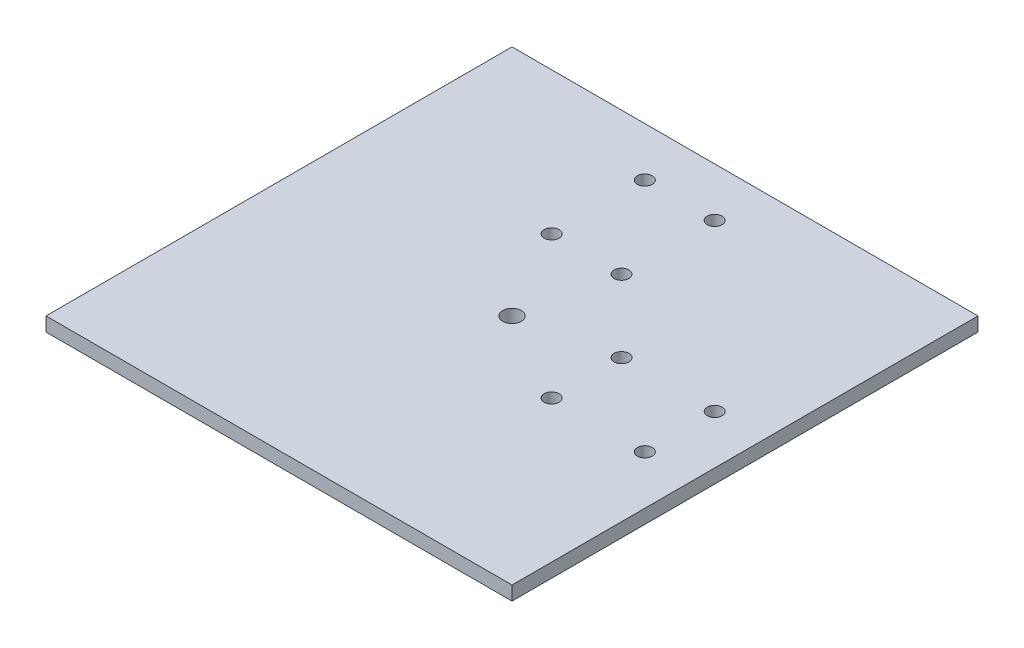
from build123d import *

# Parameters (mm, degrees)
SKETCH2_W                = 100
SKETCH2_H                = 100
BOSS_EXTRUDE1_DEPTH      = 3
SKETCH8_R                = 3
BOSS_EXTRUDE2_DEPTH      = 15.1
M3_CLEARANCE_HOLE1_D     = 3.2
F_4_0_4_DIAMETER_HOLE1_D = 4


with BuildPart() as part:
    # Sketch2 → Boss-Extrude1 (new body)
    with BuildSketch(Plane(origin=(0, 0, 0), x_dir=(1, 0, 0), z_dir=(0, 1, 0))):
        Rectangle(SKETCH2_W, SKETCH2_H)
    extrude(amount=BOSS_EXTRUDE1_DEPTH)

    # Sketch8 → Boss-Extrude2 (add)
    with BuildSketch(Plane.XZ):
        with Locations(Location((-11, -19.5, 0), (0, 0, 90))):
            Circle(SKETCH8_R)
        with Locations(Location((4, -19.5, 0), (0, 0, 90))):
            Circle(SKETCH8_R)
        with Locations(Location((4, -39.5, 0), (0, 0, 90))):
            Circle(SKETCH8_R)
        with Locations(Location((-11, -39.5, 0), (0, 0, 90))):
            Circle(SKETCH8_R)
    extrude(amount=BOSS_EXTRUDE2_DEPTH)

    # M3 Clearance Hole1 (through all)
    with Locations(Plane(origin=(0, 3, 0), x_dir=(1, 0, 0), z_dir=(0, 1, 0))):
        with Locations((-11, 39.5), (4, 39.5), (4, 19.5), (-11, 19.5), (19.5, 4), (39.5, 4), (39.5, -11), (19.5, -11)):
            Hole(M3_CLEARANCE_HOLE1_D / 2)

    # Ø4.0 (4) Diameter Hole1 (through all)
    with Locations(Plane(origin=(0, 3, 0), x_dir=(1, 0, 0), z_dir=(0, 1, 0))):
        with Locations((0, 0)):
            Hole(F_4_0_4_DIAMETER_HOLE1_D / 2)


solid = part.part
